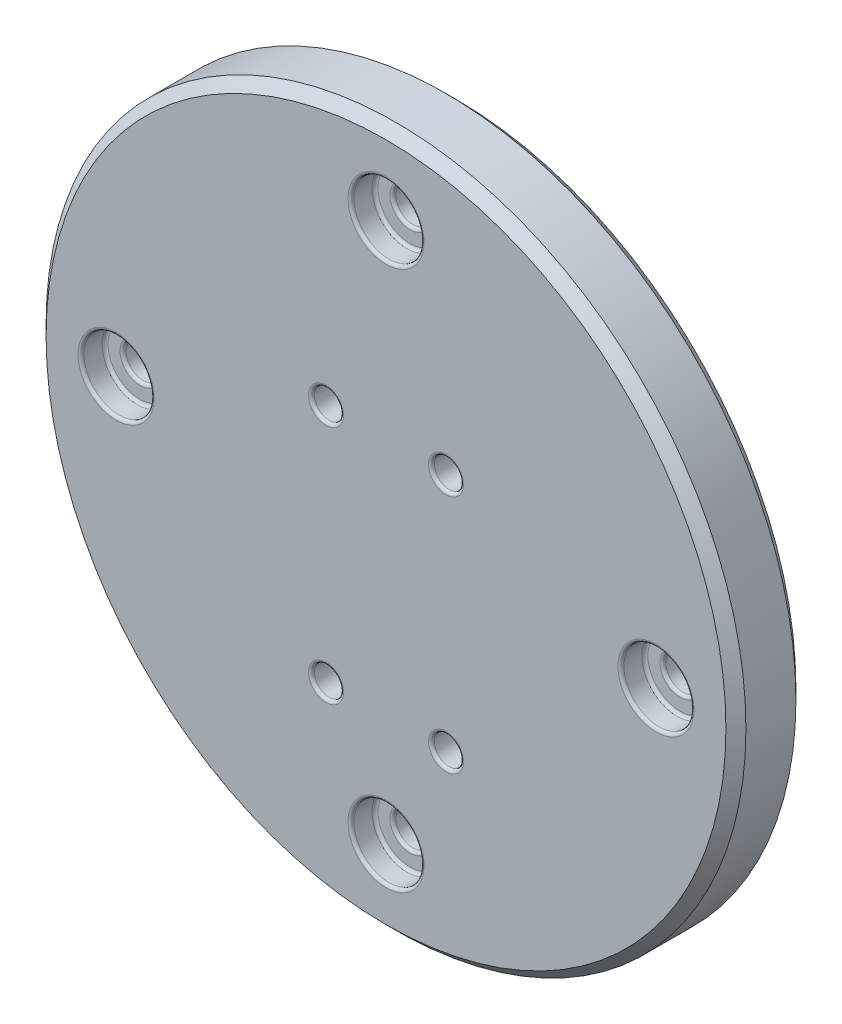
from build123d import *

# Parameters (mm, degrees)
SKETCH_1_R                     = 35
EXTRUDE_1_DEPTH                = 3.5
HOLE_WIZARD_M2_5_1_D           = 2.9
HOLE_WIZARD_M2_5_1_CBORE_D     = 6
HOLE_WIZARD_M2_5_1_CBORE_DEPTH = 3
FILLET_1_R                     = 0.3
HOLE_WIZARD_M3_2_D             = 3.4
HOLE_WIZARD_M3_2_CBORE_D       = 7
HOLE_WIZARD_M3_2_CBORE_DEPTH   = 2.4
FILLET_2_R                     = 0.3
CHAMFER_1_SIZE                 = 1


with BuildPart() as part:
    # 스케치1 → 보스-돌출1 (new, symmetric)
    with BuildSketch(Plane.XY):
        Circle(SKETCH_1_R)
    extrude(amount=EXTRUDE_1_DEPTH, both=True)

    # M2.5 남비 머리 나사용 카운터보어1 (through all)
    with Locations(Plane(origin=(0, 0, -3.5), x_dir=(-1, 0, 0), z_dir=(0, 0, -1))):
        with Locations((-6, 8), (6, 8), (-6, -16), (6, -16)):
            CounterBoreHole(HOLE_WIZARD_M2_5_1_D / 2, HOLE_WIZARD_M2_5_1_CBORE_D / 2, HOLE_WIZARD_M2_5_1_CBORE_DEPTH)

    # 필렛1
    fillet_1_edges = [part.edges().sort_by_distance(p)[0] for p in [
        (-3, -16, -0.5),
        (9, -16, -3.5),
        (4.55, -16, 3.5),
        (4.55, -16, -0.5),
        (9, -16, -0.5),
        (-3, 8, -3.5),
        (-7.45, 8, 3.5),
        (-7.45, 8, -0.5),
        (-3, 8, -0.5),
        (9, 8, -3.5),
        (4.55, 8, 3.5),
        (4.55, 8, -0.5),
        (9, 8, -0.5),
        (-3, -16, -3.5),
        (-7.45, -16, 3.5),
        (-7.45, -16, -0.5),
    ]]
    fillet(fillet_1_edges, radius=FILLET_1_R)

    # M3 남비 머리 나사용 카운터보어2 (through all)
    with Locations(Plane.XY.offset(3.5)):
        with Locations((0, 27), (27, 0), (0, -27), (-27, 0)):
            CounterBoreHole(HOLE_WIZARD_M3_2_D / 2, HOLE_WIZARD_M3_2_CBORE_D / 2, HOLE_WIZARD_M3_2_CBORE_DEPTH)

    # 필렛2
    fillet_2_edges = [part.edges().sort_by_distance(p)[0] for p in [
        (-3.5, -27, 3.5),
        (1.7, -27, -3.5),
        (1.7, -27, 1.1),
        (-3.5, -27, 1.1),
        (23.5, 0, 3.5),
        (28.7, 0, -3.5),
        (28.7, 0, 1.1),
        (23.5, 0, 1.1),
        (-3.5, 27, 3.5),
        (1.7, 27, -3.5),
        (1.7, 27, 1.1),
        (-3.5, 27, 1.1),
        (-30.5, 0, 3.5),
        (-25.3, 0, -3.5),
        (-25.3, 0, 1.1),
        (-30.5, 0, 1.1),
    ]]
    fillet(fillet_2_edges, radius=FILLET_2_R)

    # 모따기1
    chamfer_1_edges = [part.edges().sort_by_distance(p)[0] for p in [
        (-35, 0, -3.5),
        (-35, 0, 3.5),
    ]]
    chamfer(chamfer_1_edges, length=CHAMFER_1_SIZE)


solid = part.part
